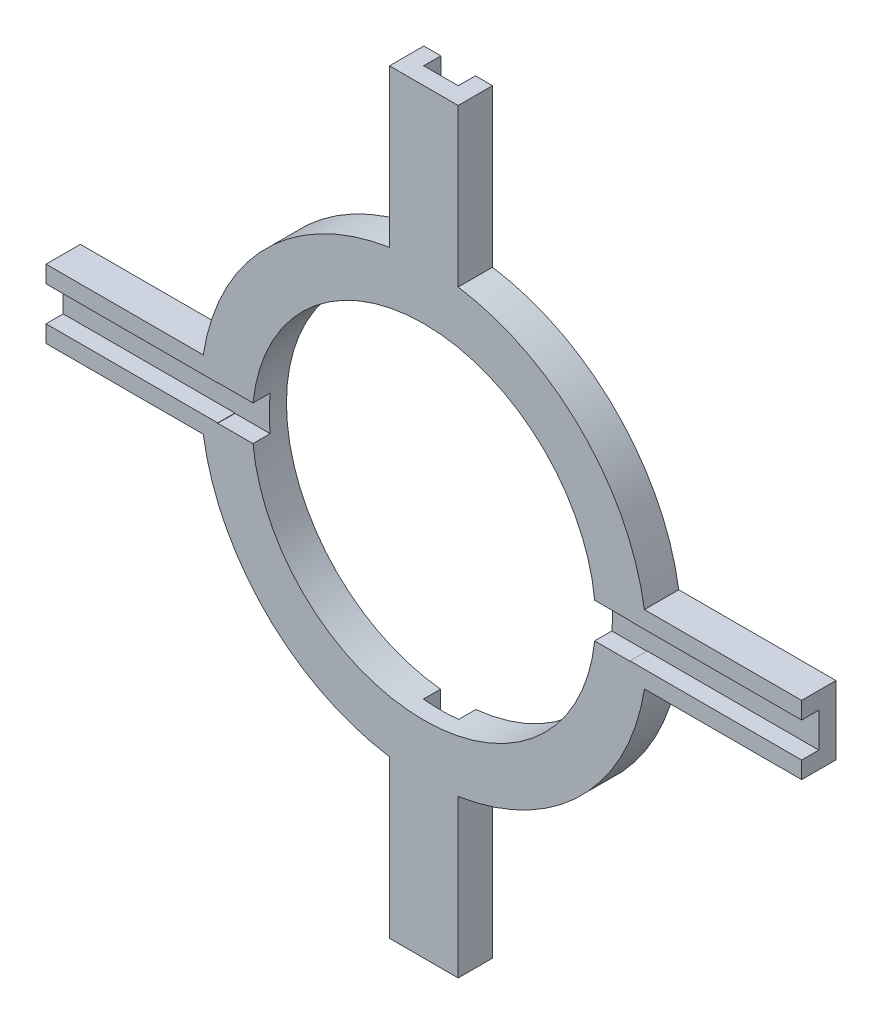
from build123d import *

# Parameters (mm, degrees)
SKETCH1_R                       = 26
SKETCH1_R_2                     = 20
RELIEVED_FLOATING_RING_DEPTH    = 4
SKETCH2_W                       = 20
SKETCH2_H                       = 8
X_SLIDE_PAD_1_DEPTH             = 4
SKETCH3_W                       = 8
SKETCH3_H                       = 20
Y_SLIDE_PAD_1_DEPTH             = 4
SKETCH4_W                       = 20
SKETCH4_H                       = 8
X_SLIDE_PAD_1_2_DEPTH           = 4
SKETCH5_W                       = 8
SKETCH5_H                       = 20
Y_SLIDE_PAD_1_2_DEPTH           = 4
SKETCH6_W                       = 4.1
SKETCH6_H                       = 90
LOWER_Y_SLOTS_W4P1_H2_DEPTH     = 2
SKETCH7_W                       = 90
SKETCH7_H                       = 4.1
UPPER_X_SLOTS_W4P1_H2_DEPTH     = 2
BENCH_UPPERX_W4P030_1_1_START   = 2
SKETCH8_W                       = 20
SKETCH8_H                       = 0.045
BENCH_UPPERX_W4P030_1_1_DEPTH   = 2
SKETCH9_W                       = 20
SKETCH9_H                       = 0.045
BENCH_UPPERX_W4P030_1_1_2_DEPTH = 2
SKETCH10_W                      = 20
SKETCH10_H                      = 0.045
BENCH_UPPERX_W4P030_1_1_3_DEPTH = 2
SKETCH11_W                      = 20
SKETCH11_H                      = 0.045
BENCH_UPPERX_W4P030_1_1_4_DEPTH = 2
SKETCH12_W                      = 0.045
SKETCH12_H                      = 20
BENCH_LOWERY_W4P030_1_1_DEPTH   = 2
SKETCH13_W                      = 0.045
SKETCH13_H                      = 20
BENCH_LOWERY_W4P030_1_1_2_DEPTH = 2
SKETCH14_W                      = 0.045
SKETCH14_H                      = 20
BENCH_LOWERY_W4P030_1_1_3_DEPTH = 2
SKETCH15_W                      = 0.045
SKETCH15_H                      = 20
BENCH_LOWERY_W4P030_1_1_4_DEPTH = 2


with BuildPart() as part:
    # Sketch1 → Relieved_Floating_Ring (new body)
    with BuildSketch(Plane.XY):
        Circle(SKETCH1_R)
        Circle(SKETCH1_R_2, mode=Mode.SUBTRACT)
    extrude(amount=RELIEVED_FLOATING_RING_DEPTH)

    # Sketch2 → X_Slide_Pad_-1 (add)
    with BuildSketch(Plane.XY):
        with Locations((-34, 0)):
            Rectangle(SKETCH2_W, SKETCH2_H)
    extrude(amount=X_SLIDE_PAD_1_DEPTH)

    # Sketch3 → Y_Slide_Pad_-1 (add)
    with BuildSketch(Plane.XY):
        with Locations((0, -34)):
            Rectangle(SKETCH3_W, SKETCH3_H)
    extrude(amount=Y_SLIDE_PAD_1_DEPTH)

    # Sketch4 → X_Slide_Pad_1 2 (add)
    with BuildSketch(Plane.XY):
        with Locations((34, 0)):
            Rectangle(SKETCH4_W, SKETCH4_H)
    extrude(amount=X_SLIDE_PAD_1_2_DEPTH)

    # Sketch5 → Y_Slide_Pad_1 2 (add)
    with BuildSketch(Plane.XY):
        with Locations((0, 34)):
            Rectangle(SKETCH5_W, SKETCH5_H)
    extrude(amount=Y_SLIDE_PAD_1_2_DEPTH)

    # Sketch6 → Lower_Y_Slots_W4p1_H2 (cut)
    with BuildSketch(Plane(origin=(0, 0, 0), x_dir=(-1, 0, 0), z_dir=(0, 0, -1))):
        Rectangle(SKETCH6_W, SKETCH6_H)
    extrude(amount=-LOWER_Y_SLOTS_W4P1_H2_DEPTH, mode=Mode.SUBTRACT)

    # Sketch7 → Upper_X_Slots_W4p1_H2 (cut)
    with BuildSketch(Plane.XY.offset(4)):
        Rectangle(SKETCH7_W, SKETCH7_H)
    extrude(amount=-UPPER_X_SLOTS_W4P1_H2_DEPTH, mode=Mode.SUBTRACT)

    # Sketch8 → Bench_UpperX_W4p030_-1_-1 (add)
    with BuildSketch(Plane.XY.offset(BENCH_UPPERX_W4P030_1_1_START)):
        with Locations((-34, -2.0375)):
            Rectangle(SKETCH8_W, SKETCH8_H)
    extrude(amount=BENCH_UPPERX_W4P030_1_1_DEPTH)

    # Sketch9 → Bench_UpperX_W4p030_-1_1 2 (add)
    with BuildSketch(Plane.XY.offset(BENCH_UPPERX_W4P030_1_1_START)):
        with Locations((-34, 2.0375)):
            Rectangle(SKETCH9_W, SKETCH9_H)
    extrude(amount=BENCH_UPPERX_W4P030_1_1_2_DEPTH)

    # Sketch10 → Bench_UpperX_W4p030_1_-1 3 (add)
    with BuildSketch(Plane.XY.offset(BENCH_UPPERX_W4P030_1_1_START)):
        with Locations((34, -2.0375)):
            Rectangle(SKETCH10_W, SKETCH10_H)
    extrude(amount=BENCH_UPPERX_W4P030_1_1_3_DEPTH)

    # Sketch11 → Bench_UpperX_W4p030_1_1 4 (add)
    with BuildSketch(Plane.XY.offset(BENCH_UPPERX_W4P030_1_1_START)):
        with Locations((34, 2.0375)):
            Rectangle(SKETCH11_W, SKETCH11_H)
    extrude(amount=BENCH_UPPERX_W4P030_1_1_4_DEPTH)

    # Sketch12 → Bench_LowerY_W4p030_-1_-1 (add)
    with BuildSketch(Plane.XY):
        with Locations((-2.0375, -34)):
            Rectangle(SKETCH12_W, SKETCH12_H)
    extrude(amount=BENCH_LOWERY_W4P030_1_1_DEPTH)

    # Sketch13 → Bench_LowerY_W4p030_-1_1 2 (add)
    with BuildSketch(Plane.XY):
        with Locations((2.0375, -34)):
            Rectangle(SKETCH13_W, SKETCH13_H)
    extrude(amount=BENCH_LOWERY_W4P030_1_1_2_DEPTH)

    # Sketch14 → Bench_LowerY_W4p030_1_-1 3 (add)
    with BuildSketch(Plane.XY):
        with Locations((-2.0375, 34)):
            Rectangle(SKETCH14_W, SKETCH14_H)
    extrude(amount=BENCH_LOWERY_W4P030_1_1_3_DEPTH)

    # Sketch15 → Bench_LowerY_W4p030_1_1 4 (add)
    with BuildSketch(Plane.XY):
        with Locations((2.0375, 34)):
            Rectangle(SKETCH15_W, SKETCH15_H)
    extrude(amount=BENCH_LOWERY_W4P030_1_1_4_DEPTH)


solid = part.part
